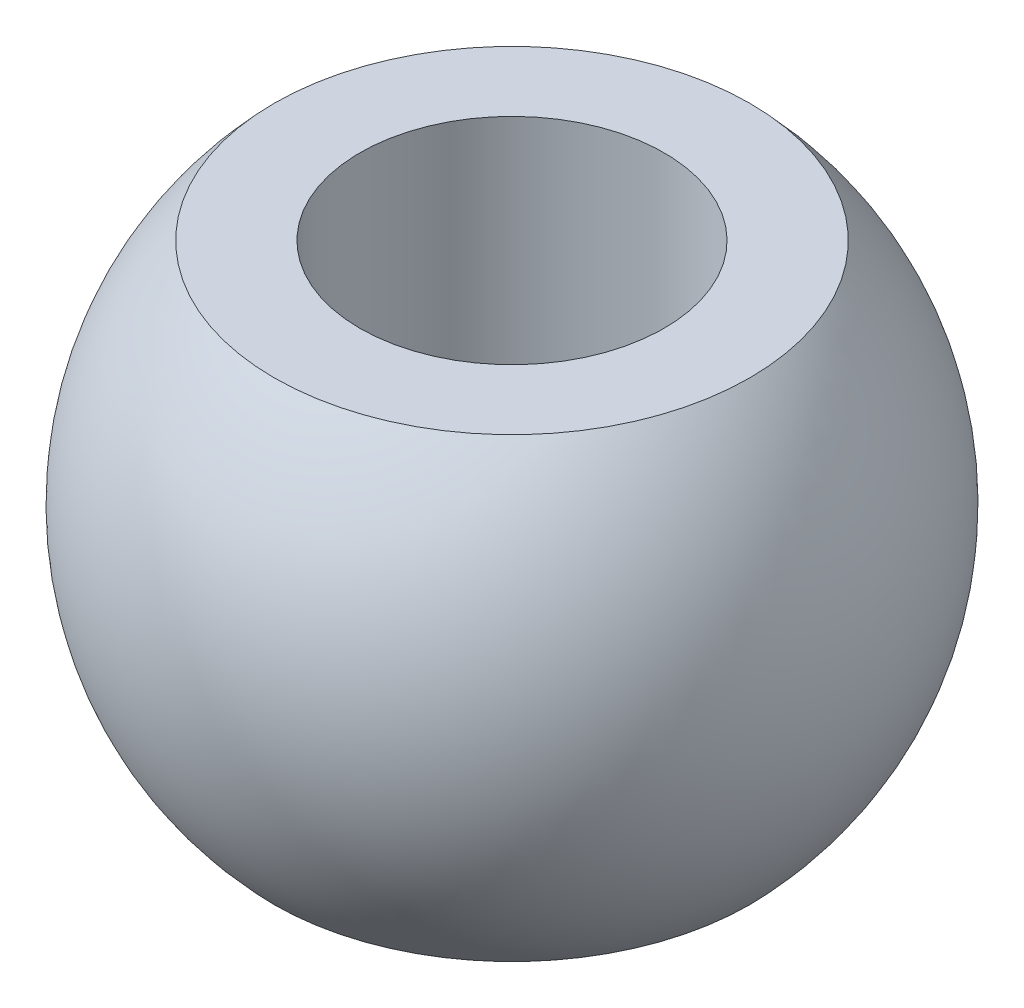
from build123d import *


with BuildPart() as part:
    # Sketch1 → Revolve1 (revolve)
    with BuildSketch(Plane.XY):
        with BuildLine():
            Line((1.5, -2.25), (2.34520788, -2.25))
            ThreePointArc((2.34520788, -2.25), (3.25, 0), (2.34520788, 2.25))
            Line((2.34520788, 2.25), (1.5, 2.25))
            Line((1.5, 2.25), (1.5, -2.25))
        make_face()
    revolve(axis=Axis((0, 10.053993848, 0), (0, -1, 0)))


solid = part.part
